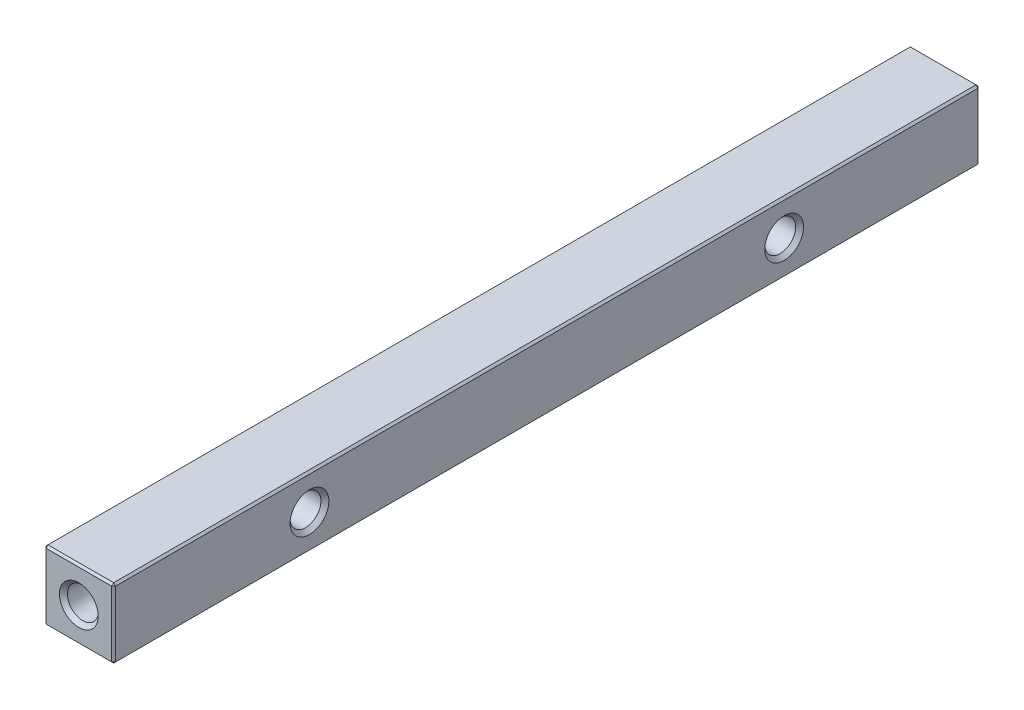
from build123d import *

# Parameters (mm, degrees)
SKETCH1_W           = 8.8
SKETCH1_H           = 8.8
BOSS_EXTRUDE1_DEPTH = 54.75
SKETCH2_R           = 1.95
CUT_EXTRUDE1_DEPTH  = 8
CUT_EXTRUDE2_REACH  = 57.627
SKETCH3_R           = 1.95
CHAMFER1_SIZE       = 0.5
CHAMFER2_SIZE       = 0.25


with BuildPart() as part:
    # Sketch1 → Boss-Extrude1 (new, symmetric)
    with BuildSketch(Plane.XY):
        Rectangle(SKETCH1_W, SKETCH1_H)
    extrude(amount=BOSS_EXTRUDE1_DEPTH, both=True)

    # Sketch2 → Cut-Extrude1 (cut)
    with BuildSketch(Plane.XY.offset(54.75)):
        Circle(SKETCH2_R)
    cut_extrude1 = extrude(amount=-CUT_EXTRUDE1_DEPTH, mode=Mode.SUBTRACT)

    # Mirror1: Cut-Extrude1 across plane
    add(cut_extrude1.mirror(Plane.XY), mode=Mode.SUBTRACT)

    # Sketch3 → Cut-Extrude2 (cut, up to next)
    with BuildSketch(Plane(origin=(4.4, 0, 0), x_dir=(0, 0, -1), z_dir=(1, 0, 0)), mode=Mode.PRIVATE) as cut_extrude2_sk1:
        with Locations((-30, 0)):
            Circle(SKETCH3_R)
    cut_extrude2_tool1 = extrude(cut_extrude2_sk1.sketch, amount=-CUT_EXTRUDE2_REACH, mode=Mode.PRIVATE) & part.part
    # Sketch3 → Cut-Extrude2 (cut, up to next)
    with BuildSketch(Plane(origin=(4.4, 0, 0), x_dir=(0, 0, -1), z_dir=(1, 0, 0)), mode=Mode.PRIVATE) as cut_extrude2_sk2:
        with Locations((30, 0)):
            Circle(SKETCH3_R)
    cut_extrude2_tool2 = extrude(cut_extrude2_sk2.sketch, amount=-CUT_EXTRUDE2_REACH, mode=Mode.PRIVATE) & part.part
    add(cut_extrude2_tool1.solids().sort_by_distance((4.4, 0, 30))[0], mode=Mode.SUBTRACT)
    add(cut_extrude2_tool2.solids().sort_by_distance((4.4, 0, -30))[0], mode=Mode.SUBTRACT)

    # Chamfer1
    chamfer1_edges = [part.edges().sort_by_distance(p)[0] for p in [
        (-1.95, 0, 54.75),
        (-1.95, 0, -54.75),
        (4.4, 0, 31.95),
        (-4.4, 0, 31.95),
        (4.4, 0, -28.05),
        (-4.4, 0, -28.05),
    ]]
    chamfer(chamfer1_edges, length=CHAMFER1_SIZE)

    # Chamfer2
    chamfer2_edges = [part.edges().sort_by_distance(p)[0] for p in [
        (-4.4, 0, 54.75),
        (0, -4.4, 54.75),
        (4.4, 0, 54.75),
        (0, -4.4, -54.75),
        (-4.4, 0, -54.75),
        (0, 4.4, -54.75),
        (4.4, 0, -54.75),
        (4.4, -4.4, 0),
        (-4.4, -4.4, 0),
        (-4.4, 4.4, 0),
        (4.4, 4.4, 0),
        (0, 4.4, 54.75),
    ]]
    chamfer(chamfer2_edges, length=CHAMFER2_SIZE)


solid = part.part
